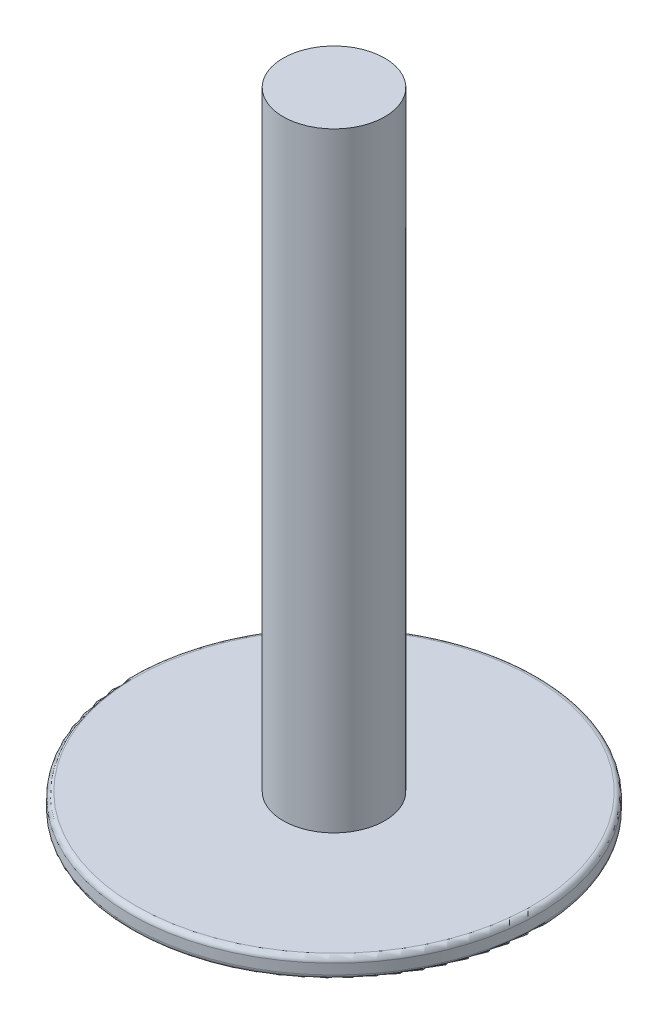
from build123d import *

# Parameters (mm, degrees)
SKETCH1_W          = 60
SKETCH1_H          = 5
CUT_EXTRUDE1_START = 1
CUT_EXTRUDE1_DEPTH = 10
FILLET1_R          = 0.5


with BuildPart() as part:
    # Sketch1 → Revolve1 (revolve)
    with BuildSketch(Plane.YZ, mode=Mode.PRIVATE) as revolve1_sk:
        with BuildLine():
            Line((-10, 0), (-2, 0))
            Line((-2, 0), (-2, 15))
            ThreePointArc((-2, 15), (-8.330111387, 8.742726073), (-10, 0))
        make_face()
        Polygon((0, 20), (0, 5), (0, 0), (-2, 0), (-2, 20), align=None)
        with Locations((30, 2.5)):
            Rectangle(SKETCH1_W, SKETCH1_H)
    revolve(revolve1_sk.sketch.rotate(Axis((0, -21.912032937, 0), (0, 1, 0)), 180), axis=Axis((0, -21.912032937, 0), (0, 1, 0)))

    # Sketch2 → Cut-Extrude1 (cut)
    with BuildSketch(Plane.XZ.offset(2).offset(CUT_EXTRUDE1_START)):
        Polygon((4, -6.92820323), (8, 0), (4, 6.92820323), (-4, 6.92820323), (-8, 0), (-4, -6.92820323), align=None)
    extrude(amount=CUT_EXTRUDE1_DEPTH, mode=Mode.SUBTRACT)

    # Fillet1
    fillet1_edges = [part.edges().sort_by_distance(p)[0] for p in [
        (-6, -9.148190897, -3.464101615),
        (-6, -9.148190897, 3.464101615),
        (0, -9.148190897, 6.92820323),
        (6, -9.148190897, 3.464101615),
        (6, -9.148190897, -3.464101615),
        (-2.012812506, -9.037939191, -6.92820323),
        (-4, -5.850108704, -6.92820323),
        (0, -3, -6.92820323),
        (4, -5.850108704, -6.92820323),
        (6, -3, -3.464101615),
        (8, -5.850108704, 0),
        (6, -3, 3.464101615),
        (4, -5.850108704, 6.92820323),
        (0, -3, 6.92820323),
        (-4, -5.850108704, 6.92820323),
        (-6, -3, 3.464101615),
        (-8, -5.850108704, 0),
        (-6, -3, -3.464101615),
        (0, -2, 20),
        (0, 0, 20),
    ]]
    fillet(fillet1_edges, radius=FILLET1_R)


solid = part.part
